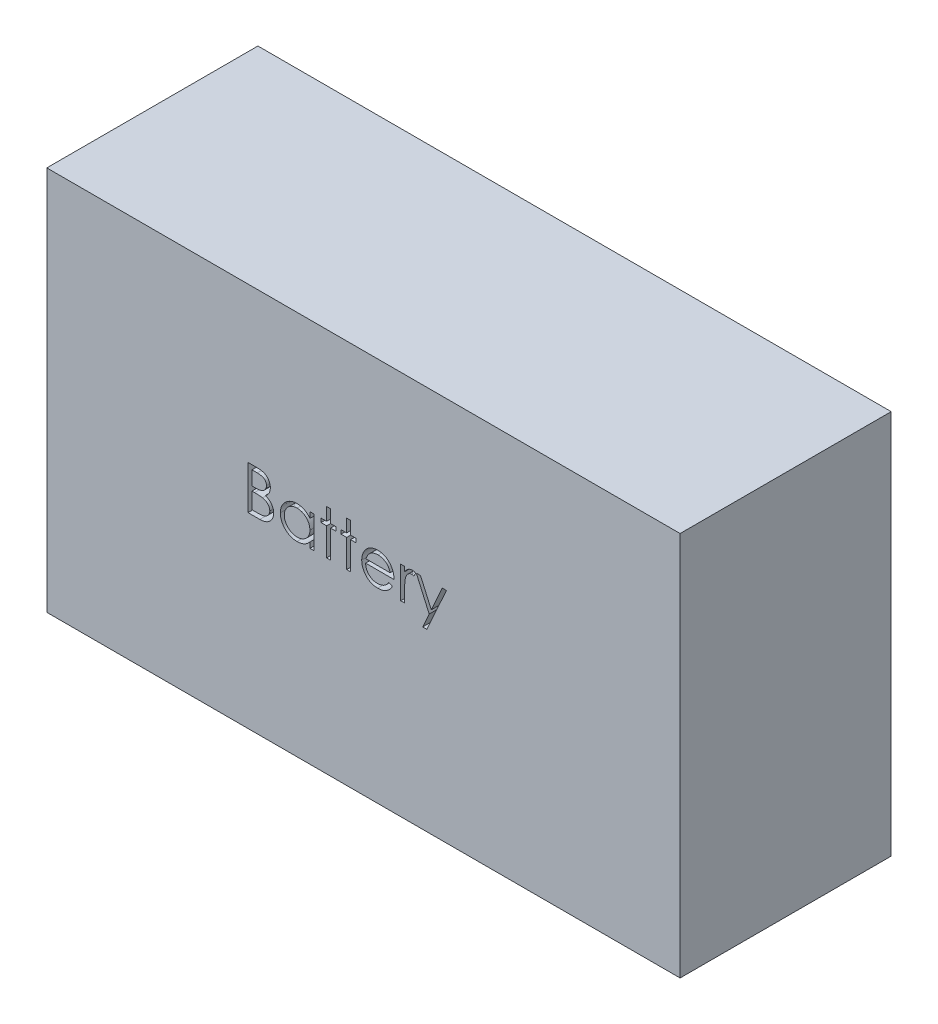
from build123d import *

# Parameters (mm, degrees)
SKETCH1_W           = 51
SKETCH1_H           = 31
BOSS_EXTRUDE1_DEPTH = 17
CUT_EXTRUDE1_DEPTH  = 2


with BuildPart() as part:
    # Sketch1 → Boss-Extrude1 (new body)
    with BuildSketch(Plane.XY):
        Rectangle(SKETCH1_W, SKETCH1_H)
    extrude(amount=BOSS_EXTRUDE1_DEPTH)

    # Sketch2 → Cut-Extrude1 (cut)
    # profile 1 of 7: a face of its own
    with BuildSketch(Plane.XY.offset(17)):
        with BuildLine():
            Line((-9.294257409, 3.05980533), (-8.611364781, 3.05980533))
            add(Edge.make_bspline(
                [(-8.611364781, 3.05980533), (-8.577936303, 3.05962958), (-8.513143593, 3.059288932), (-8.418924151, 3.054005801), (-8.33067534, 3.046802131), (-8.248371568, 3.035372038), (-8.172050865, 3.021580261), (-8.101483228, 3.004878445), (-8.036893056, 2.984851831), (-7.959780319, 2.95300555), (-7.871859659, 2.905682382), (-7.776661266, 2.835753816), (-7.695257026, 2.750221353), (-7.625070709, 2.653738698), (-7.56926959, 2.547602926), (-7.528900292, 2.434343737), (-7.503342417, 2.315421996), (-7.500713983, 2.233778818), (-7.499385614, 2.19251767)],
                knots=[0, 0, 0, 0, 1.001505555, 1.941167018, 2.826882275, 3.653841531, 4.429895133, 5.150066043, 5.825578002, 6.45369114, 7.647487171, 8.808567382, 9.977351308, 11.170798116, 12.373658725, 13.556498008, 14.765093433, 16, 16, 16, 16], degree=3))
            add(Edge.make_bspline(
                [(-7.499385614, 2.19251767), (-7.500478833, 2.153865114), (-7.50262711, 2.077909197), (-7.52316987, 1.966815088), (-7.555330538, 1.861063869), (-7.600035787, 1.761041484), (-7.658137783, 1.669007871), (-7.726996102, 1.584220605), (-7.810072904, 1.510269548), (-7.872316144, 1.468926645), (-7.90393289, 1.447926324)],
                knots=[0, 0, 0, 0, 1.044552857, 2.05264487, 3.044412934, 4.028983338, 5.005914585, 5.980388656, 6.974128949, 8, 8, 8, 8], degree=3))
            add(Edge.make_bspline(
                [(-7.90393289, 1.447926324), (-7.864172462, 1.432661325), (-7.788100915, 1.4034556), (-7.683414903, 1.351820136), (-7.593220058, 1.295658026), (-7.516822912, 1.234326176), (-7.451485257, 1.168217365), (-7.394432315, 1.096362251), (-7.345750941, 1.017823493), (-7.304038017, 0.933419958), (-7.271489261, 0.844013489), (-7.247113357, 0.750442713), (-7.233145908, 0.653043158), (-7.231158267, 0.586757779), (-7.230154845, 0.553294914)],
                knots=[0, 0, 0, 0, 1.27268992, 2.434971085, 3.483601985, 4.442670788, 5.356604649, 6.2567628, 7.179492994, 8.113709626, 9.066344395, 10.018646069, 10.999752585, 12, 12, 12, 12], degree=3))
            add(Edge.make_bspline(
                [(-7.230154845, 0.553294914), (-7.231131691, 0.519128041), (-7.233053663, 0.451903763), (-7.247233635, 0.353148629), (-7.271242742, 0.258773682), (-7.304313888, 0.168168499), (-7.347476203, 0.081508365), (-7.400004167, -0.001304899), (-7.462635731, -0.07943923), (-7.5326986, -0.153762853), (-7.611960745, -0.22059064), (-7.6974765, -0.280106347), (-7.79032282, -0.329052409), (-7.888974814, -0.37016843), (-7.99453913, -0.401575629), (-8.106541738, -0.423548203), (-8.224886039, -0.43835324), (-8.306095791, -0.439570445), (-8.347742986, -0.44019467)],
                knots=[0, 0, 0, 0, 0.978564426, 1.925352924, 2.850884081, 3.763762016, 4.682927383, 5.618979971, 6.567305752, 7.547517671, 8.540179244, 9.531824382, 10.526200242, 11.540722885, 12.589160233, 13.674978461, 14.80764778, 16, 16, 16, 16], degree=3))
            Line((-8.347742986, -0.44019467), (-9.294257409, -0.44019467))
            Line((-9.294257409, -0.44019467), (-9.294257409, 3.05980533))
        make_face()
        with BuildLine():
            Line((-8.980154845, 2.700830971), (-8.980154845, 1.579036099))
            Line((-8.980154845, 1.579036099), (-8.769117185, 1.579036099))
            add(Edge.make_bspline(
                [(-8.769117185, 1.579036099), (-8.73826839, 1.579436022), (-8.67866223, 1.580208755), (-8.592342334, 1.582422272), (-8.512217316, 1.588620316), (-8.438425482, 1.594816578), (-8.371083039, 1.604891165), (-8.310339177, 1.616883288), (-8.25524058, 1.629566193), (-8.191701035, 1.65113568), (-8.119628086, 1.683013355), (-8.042794982, 1.732485192), (-7.975060512, 1.791409545), (-7.917863325, 1.859400507), (-7.871051854, 1.934266692), (-7.838538139, 2.014813573), (-7.816490855, 2.099033705), (-7.814499323, 2.156851958), (-7.813488179, 2.186207574)],
                knots=[0, 0, 0, 0, 1.156816544, 2.235205308, 3.236616184, 4.169592532, 5.011045266, 5.787822928, 6.49130361, 7.128639758, 8.301311294, 9.436451833, 10.541879658, 11.654887649, 12.756523258, 13.837046038, 14.901820046, 16, 16, 16, 16], degree=3))
            add(Edge.make_bspline(
                [(-7.813488179, 2.186207574), (-7.814014359, 2.205633345), (-7.815046519, 2.243739117), (-7.823499821, 2.299288472), (-7.837867396, 2.351532224), (-7.856321689, 2.401186334), (-7.882110378, 2.446698185), (-7.912473841, 2.48964138), (-7.949159531, 2.528553499), (-7.990916844, 2.564922997), (-8.038925467, 2.597167525), (-8.093156759, 2.625408288), (-8.154344436, 2.648149065), (-8.221457291, 2.668065217), (-8.295528378, 2.682053511), (-8.375702931, 2.693706899), (-8.46263765, 2.699639641), (-8.522782753, 2.700425004), (-8.553872794, 2.700830971)],
                knots=[0, 0, 0, 0, 0.91205012, 1.789085906, 2.630437955, 3.453916878, 4.269457761, 5.079663411, 5.91843418, 6.774407191, 7.675494373, 8.627863946, 9.638891023, 10.736472738, 11.911756761, 13.175263542, 14.539845004, 16, 16, 16, 16], degree=3))
            Line((-8.553872794, 2.700830971), (-8.980154845, 2.700830971))
        make_face(mode=Mode.SUBTRACT)
        with BuildLine():
            Line((-8.980154845, 1.22006174), (-8.980154845, -0.081220311))
            Line((-8.980154845, -0.081220311), (-8.53283914, -0.081220311))
            add(Edge.make_bspline(
                [(-8.53283914, -0.081220311), (-8.500820214, -0.080836563), (-8.439107956, -0.080096941), (-8.350006725, -0.077682386), (-8.267423622, -0.072190111), (-8.191735486, -0.063544261), (-8.122125033, -0.054165812), (-8.05942733, -0.041554531), (-8.003134137, -0.02710557), (-7.937859829, -0.004771398), (-7.864356321, 0.029925073), (-7.785145464, 0.082239299), (-7.714719246, 0.144562607), (-7.654913987, 0.216693521), (-7.605900998, 0.295124848), (-7.570245543, 0.378270198), (-7.548254687, 0.464755725), (-7.545592517, 0.523722438), (-7.544257409, 0.553294914)],
                knots=[0, 0, 0, 0, 1.160039823, 2.235823828, 3.228722157, 4.157150951, 4.99529583, 5.772374946, 6.472645482, 7.099169577, 8.269452708, 9.405989375, 10.527446681, 11.663510218, 12.788923519, 13.866172445, 14.929861265, 16, 16, 16, 16], degree=3))
            add(Edge.make_bspline(
                [(-7.544257409, 0.553294914), (-7.544533514, 0.571788254), (-7.545081269, 0.608476636), (-7.553341884, 0.662392455), (-7.565355753, 0.714618328), (-7.580887187, 0.765296069), (-7.603506654, 0.813509445), (-7.629913199, 0.860212005), (-7.660874601, 0.905465484), (-7.709118767, 0.962677738), (-7.779290751, 1.02859475), (-7.878997527, 1.093132253), (-7.992369825, 1.14518006), (-8.074597318, 1.167279536), (-8.117073916, 1.178695555)],
                knots=[0, 0, 0, 0, 0.723448775, 1.435228256, 2.130040452, 2.821711965, 3.505591119, 4.210454504, 4.921174351, 5.648778258, 7.137944449, 8.670945889, 10.280296675, 12, 12, 12, 12], degree=3))
            add(Edge.make_bspline(
                [(-8.117073916, 1.178695555), (-8.134103012, 1.182150639), (-8.171025604, 1.189641973), (-8.231233184, 1.197549677), (-8.299969053, 1.204594736), (-8.37739193, 1.209805894), (-8.463599772, 1.215192438), (-8.55877669, 1.217287259), (-8.662534005, 1.219786519), (-8.734526377, 1.219967653), (-8.771921672, 1.22006174)],
                knots=[0, 0, 0, 0, 0.634451884, 1.375622551, 2.216452059, 3.157844607, 4.20941857, 5.370758133, 6.634282058, 8, 8, 8, 8], degree=3))
            Line((-8.771921672, 1.22006174), (-8.980154845, 1.22006174))
        make_face(mode=Mode.SUBTRACT)
    # profile 2 of 7: a face of its own
    with BuildSketch(Plane.XY.offset(17)):
        with BuildLine():
            Line((-3.999385614, 2.117497638), (-3.999385614, -0.44019467))
            Line((-3.999385614, -0.44019467), (-4.313488179, -0.44019467))
            Line((-4.313488179, -0.44019467), (-4.313488179, 0.002213183))
            add(Edge.make_bspline(
                [(-4.313488179, 0.002213183), (-4.348906969, -0.037826411), (-4.418027184, -0.115964182), (-4.533468302, -0.218046355), (-4.65583648, -0.302424676), (-4.784537801, -0.370574592), (-4.919456045, -0.421766648), (-5.060292132, -0.458152807), (-5.207103513, -0.481546643), (-5.307355868, -0.483882665), (-5.358159653, -0.485066465)],
                knots=[0, 0, 0, 0, 1.074387032, 2.096679803, 3.090159297, 4.057316773, 5.018401886, 5.985159533, 6.978961417, 8, 8, 8, 8], degree=3))
            add(Edge.make_bspline(
                [(-5.358159653, -0.485066465), (-5.403327607, -0.483840092), (-5.492400812, -0.481421632), (-5.623429889, -0.462659328), (-5.749522138, -0.432528707), (-5.870796711, -0.390627817), (-5.986468856, -0.335046996), (-6.097528953, -0.268505748), (-6.203401645, -0.189264917), (-6.302473184, -0.098676889), (-6.393705184, -0.000281902), (-6.473766457, 0.104663645), (-6.540519537, 0.215705949), (-6.596339618, 0.331439103), (-6.639335962, 0.452754022), (-6.669309596, 0.57923119), (-6.688050043, 0.710721064), (-6.690467504, 0.800260587), (-6.691693307, 0.845662702)],
                knots=[0, 0, 0, 0, 1.033919861, 2.038935746, 3.024066025, 3.998881131, 4.97069526, 5.957263378, 6.95902576, 7.993208707, 9.027059324, 10.027763471, 11.009749337, 11.988697705, 12.965288445, 13.950418724, 14.960734635, 16, 16, 16, 16], degree=3))
            add(Edge.make_bspline(
                [(-6.691693307, 0.845662702), (-6.690440335, 0.890126406), (-6.687963279, 0.978028749), (-6.669510059, 1.107307447), (-6.63847905, 1.231825708), (-6.594931202, 1.351182651), (-6.539089247, 1.465522701), (-6.47116116, 1.574926726), (-6.391142036, 1.679696123), (-6.298889629, 1.77736735), (-6.198954858, 1.867587965), (-6.092046128, 1.94599701), (-5.980822846, 2.013713859), (-5.863559836, 2.067367335), (-5.741992731, 2.11077644), (-5.615039285, 2.140809408), (-5.483227706, 2.158506729), (-5.393737214, 2.161069493), (-5.348343948, 2.162369433)],
                knots=[0, 0, 0, 0, 1.020392517, 2.01726096, 2.990465484, 3.961182959, 4.928053699, 5.906110375, 6.912531644, 7.948652711, 8.985773172, 9.998621852, 10.987621588, 11.969261332, 12.953316658, 13.946091881, 14.958173133, 16, 16, 16, 16], degree=3))
            add(Edge.make_bspline(
                [(-5.348343948, 2.162369433), (-5.296144089, 2.160931681), (-5.193782629, 2.158112318), (-5.044054619, 2.134649591), (-4.902410142, 2.095011124), (-4.76775579, 2.041093626), (-4.640575103, 1.969444897), (-4.522072119, 1.879064936), (-4.411006636, 1.770523749), (-4.346626344, 1.687153304), (-4.313488179, 1.644240426)],
                knots=[0, 0, 0, 0, 1.038897134, 2.037228247, 3.008116434, 3.962042015, 4.918381754, 5.904844433, 6.921570401, 8, 8, 8, 8], degree=3))
            Line((-4.313488179, 1.644240426), (-4.313488179, 2.117497638))
            Line((-4.313488179, 2.117497638), (-3.999385614, 2.117497638))
        make_face()
        with BuildLine():
            add(Edge.make_bspline(
                [(-5.344137217, 1.848266869), (-5.390051555, 1.846633231), (-5.480679155, 1.84340869), (-5.613723157, 1.818235195), (-5.741036571, 1.7763506), (-5.861982645, 1.719068699), (-5.974650862, 1.647039963), (-6.075344533, 1.559918579), (-6.164887234, 1.460081565), (-6.240195498, 1.347979455), (-6.301585995, 1.227801364), (-6.344753027, 1.102176926), (-6.373222275, 0.973371948), (-6.376130795, 0.886009262), (-6.377590743, 0.842157093)],
                knots=[0, 0, 0, 0, 1.031046209, 2.035121221, 3.029706178, 4.034933723, 5.034054252, 6.02443088, 7.017295772, 8.038157696, 9.050218397, 10.03989886, 11.016116709, 12, 12, 12, 12], degree=3))
            add(Edge.make_bspline(
                [(-6.377590743, 0.842157093), (-6.375725849, 0.798566986), (-6.372003372, 0.71155763), (-6.345252678, 0.582577053), (-6.300372805, 0.456923011), (-6.239130742, 0.335662018), (-6.162444117, 0.223077917), (-6.073555465, 0.121337795), (-5.971605183, 0.033848206), (-5.858677676, -0.039389367), (-5.738069706, -0.098551888), (-5.611235774, -0.139717528), (-5.480560136, -0.166295308), (-5.391707802, -0.169399785), (-5.346941704, -0.170963901)],
                knots=[0, 0, 0, 0, 0.979072187, 1.954306742, 2.945804271, 3.96968567, 4.997920485, 5.998718438, 6.996577872, 8.005894225, 9.015743152, 10.005417472, 10.995077863, 12, 12, 12, 12], degree=3))
            add(Edge.make_bspline(
                [(-5.346941704, -0.170963901), (-5.301495201, -0.169303937), (-5.211106615, -0.166002433), (-5.077667907, -0.140721168), (-4.948172944, -0.098952369), (-4.824385716, -0.041053243), (-4.709069585, 0.030704113), (-4.605571707, 0.114711204), (-4.518055739, 0.212414388), (-4.443863129, 0.319790841), (-4.385687712, 0.437502838), (-4.343311653, 0.562837029), (-4.318257747, 0.695797777), (-4.315100018, 0.786661704), (-4.313488179, 0.83304251)],
                knots=[0, 0, 0, 0, 1.01762866, 2.023962475, 3.030623092, 4.058876274, 5.077231937, 6.066672613, 7.034107872, 8.005628644, 8.981990164, 9.965428785, 10.961468474, 12, 12, 12, 12], degree=3))
            add(Edge.make_bspline(
                [(-4.313488179, 0.83304251), (-4.314447835, 0.86838034), (-4.316336742, 0.937936374), (-4.330767312, 1.040063891), (-4.353722238, 1.137797617), (-4.386068408, 1.231240306), (-4.428559693, 1.319875322), (-4.479807459, 1.404339082), (-4.540712908, 1.484192293), (-4.610295604, 1.558335364), (-4.686460807, 1.625961826), (-4.767055348, 1.686326067), (-4.853034095, 1.73591484), (-4.942951131, 1.776956111), (-5.036962466, 1.809615261), (-5.135833086, 1.831402955), (-5.238512073, 1.846363276), (-5.308558128, 1.847625657), (-5.344137217, 1.848266869)],
                knots=[0, 0, 0, 0, 1.050140795, 2.067009409, 3.05949893, 4.030605086, 5.00011959, 5.97591094, 6.962425594, 7.979863591, 8.993523472, 9.986985069, 10.967611495, 11.937549037, 12.921786183, 13.919465291, 14.943216303, 16, 16, 16, 16], degree=3))
        make_face(mode=Mode.SUBTRACT)
    # profile 3 of 7: a face of its own
    with BuildSketch(Plane.XY.offset(17)):
        Polygon((-2.967334332, 3.14954892), (-2.653231768, 3.14954892), (-2.653231768, 2.117497638), (-2.20451382, 2.117497638), (-2.20451382, 1.803395074), (-2.653231768, 1.803395074), (-2.653231768, -0.44019467), (-2.967334332, -0.44019467), (-2.967334332, 1.803395074), (-3.416052281, 1.803395074), (-3.416052281, 2.117497638), (-2.967334332, 2.117497638), align=None)
    # profile 4 of 7: a face of its own
    with BuildSketch(Plane.XY.offset(17)):
        Polygon((-1.351949717, 3.14954892), (-1.037847153, 3.14954892), (-1.037847153, 2.117497638), (-0.589129204, 2.117497638), (-0.589129204, 1.803395074), (-1.037847153, 1.803395074), (-1.037847153, -0.44019467), (-1.351949717, -0.44019467), (-1.351949717, 1.803395074), (-1.800667666, 1.803395074), (-1.800667666, 2.117497638), (-1.351949717, 2.117497638), align=None)
    # profile 5 of 7: a face of its own
    with BuildSketch(Plane.XY.offset(17)):
        with BuildLine():
            Line((2.048490988, 0.367497638), (2.327537463, 0.220963183))
            add(Edge.make_bspline(
                [(2.327537463, 0.220963183), (2.305300867, 0.181519851), (2.262037259, 0.104778749), (2.187636511, -0.000653112), (2.109644438, -0.095500828), (2.02454047, -0.177230482), (1.934870791, -0.248481867), (1.840138137, -0.310819692), (1.739849319, -0.363938212), (1.633999594, -0.40869074), (1.521700043, -0.443100234), (1.402678527, -0.467404455), (1.276707031, -0.482427724), (1.190360851, -0.484172864), (1.146147238, -0.485066465)],
                knots=[0, 0, 0, 0, 1.120438281, 2.179929193, 3.190490725, 4.156257408, 5.095198341, 6.022838206, 6.959905092, 7.901321166, 8.864066838, 9.862729781, 10.905609505, 12, 12, 12, 12], degree=3))
            add(Edge.make_bspline(
                [(1.146147238, -0.485066465), (1.097005261, -0.483919289), (1.001143499, -0.481681483), (0.861603752, -0.462389018), (0.730224333, -0.430916659), (0.60701263, -0.386951118), (0.492270378, -0.329523794), (0.385769523, -0.259564312), (0.286949997, -0.177432057), (0.198925788, -0.082415614), (0.119681905, 0.019266343), (0.049756085, 0.125222228), (-0.008701346, 0.235185452), (-0.056253956, 0.348455976), (-0.094658821, 0.46431987), (-0.121425525, 0.583831337), (-0.136855273, 0.706666922), (-0.139219719, 0.789764257), (-0.140411255, 0.831640266)],
                knots=[0, 0, 0, 0, 1.145258523, 2.234067595, 3.276747158, 4.290159414, 5.277019952, 6.260822364, 7.254936242, 8.264827045, 9.274100331, 10.257902744, 11.220704747, 12.172965371, 13.118907548, 14.062713208, 15.023725156, 16, 16, 16, 16], degree=3))
            add(Edge.make_bspline(
                [(-0.140411255, 0.831640266), (-0.139352114, 0.870935097), (-0.137253036, 0.948812261), (-0.124022248, 1.064077806), (-0.100573955, 1.176106258), (-0.068397631, 1.284990706), (-0.026846385, 1.39054884), (0.023985834, 1.492844904), (0.084178212, 1.591770044), (0.130650885, 1.654173177), (0.154059898, 1.685606612)],
                knots=[0, 0, 0, 0, 1.024358464, 2.0301432, 3.019427413, 4.004406732, 4.986367066, 5.972626655, 6.978780325, 8, 8, 8, 8], degree=3))
            add(Edge.make_bspline(
                [(0.154059898, 1.685606612), (0.185767581, 1.723475482), (0.248178528, 1.798013633), (0.353734883, 1.895951959), (0.468035079, 1.977995734), (0.589646706, 2.04600287), (0.71998318, 2.097676517), (0.857292471, 2.136184099), (1.003138057, 2.15776211), (1.102843278, 2.160809944), (1.153859578, 2.162369433)],
                knots=[0, 0, 0, 0, 1.030682036, 2.02871468, 2.997146059, 3.962720338, 4.930598197, 5.918074684, 6.934738563, 8, 8, 8, 8], degree=3))
            add(Edge.make_bspline(
                [(1.153859578, 2.162369433), (1.206307183, 2.161015384), (1.309197429, 2.158359049), (1.45922955, 2.133732715), (1.601190267, 2.094680161), (1.735022771, 2.03952637), (1.860740632, 1.968366818), (1.977526681, 1.880224977), (2.087378194, 1.77780689), (2.151286773, 1.69904368), (2.183807495, 1.658963984)],
                knots=[0, 0, 0, 0, 1.056321875, 2.072262726, 3.055038591, 4.01806755, 4.982017516, 5.957941055, 6.960871419, 8, 8, 8, 8], degree=3))
            add(Edge.make_bspline(
                [(2.183807495, 1.658963984), (2.205934433, 1.628760403), (2.250041026, 1.568554284), (2.305288126, 1.470383127), (2.353245521, 1.367672533), (2.391578482, 1.258762235), (2.422617983, 1.144942655), (2.445074802, 1.025400111), (2.458244421, 0.900170199), (2.460833118, 0.814843644), (2.462152847, 0.771343792)],
                knots=[0, 0, 0, 0, 0.94817472, 1.890038105, 2.849395472, 3.817997239, 4.812318967, 5.836947057, 6.897266129, 8, 8, 8, 8], degree=3))
            Line((2.462152847, 0.771343792), (0.173691309, 0.771343792))
            add(Edge.make_bspline(
                [(0.173691309, 0.771343792), (0.175230915, 0.737643328), (0.178258489, 0.671372724), (0.192373632, 0.574401941), (0.214622406, 0.482028599), (0.245891469, 0.394945557), (0.283758314, 0.312015429), (0.330144031, 0.233853392), (0.385483585, 0.160815462), (0.447209284, 0.092248324), (0.515916379, 0.031187563), (0.588199127, -0.023464213), (0.665092692, -0.06926981), (0.745990775, -0.106449699), (0.83076256, -0.135556016), (0.919434755, -0.155423836), (1.011832872, -0.168730943), (1.074818606, -0.170210608), (1.106884418, -0.170963901)],
                knots=[0, 0, 0, 0, 1.094153842, 2.151609401, 3.174256925, 4.172055639, 5.149267565, 6.128595816, 7.11444997, 8.118368179, 9.117203808, 10.09244225, 11.054858984, 12.015122123, 12.976791628, 13.957293641, 14.960065497, 16, 16, 16, 16], degree=3))
            add(Edge.make_bspline(
                [(1.106884418, -0.170963901), (1.138235565, -0.170355844), (1.200442256, -0.169149343), (1.293083114, -0.157417432), (1.384222641, -0.138447156), (1.473483624, -0.112557166), (1.55905447, -0.080980314), (1.63830002, -0.042877456), (1.711180236, -0.00072771), (1.779297202, 0.047481965), (1.845368196, 0.106490152), (1.910910682, 0.180125873), (1.981187335, 0.267213401), (2.025176928, 0.332759067), (2.048490988, 0.367497638)],
                knots=[0, 0, 0, 0, 0.99110716, 1.966546729, 2.947904876, 3.932708344, 4.903319531, 5.828989031, 6.710028674, 7.56322171, 8.463672341, 9.504779593, 10.677557249, 12, 12, 12, 12], degree=3))
        make_face()
        with BuildLine():
            add(Edge.make_bspline(
                [(2.148050283, 1.085446356), (2.136553658, 1.12710923), (2.114426357, 1.20729685), (2.068189993, 1.318337741), (2.016118452, 1.417025642), (1.95449672, 1.502605275), (1.884677995, 1.578608788), (1.804032812, 1.645027373), (1.713596919, 1.704444824), (1.613837778, 1.754597323), (1.508195993, 1.797287182), (1.397589801, 1.825912298), (1.284732013, 1.84552184), (1.208397727, 1.847347949), (1.169985379, 1.848266869)],
                knots=[0, 0, 0, 0, 1.154881502, 2.222775134, 3.210006277, 4.132804581, 5.035138423, 5.962687519, 6.919655026, 7.923214229, 8.944639381, 9.960483929, 10.97369054, 12, 12, 12, 12], degree=3))
            add(Edge.make_bspline(
                [(1.169985379, 1.848266869), (1.138635941, 1.847655197), (1.076664692, 1.846446051), (0.985363623, 1.834975922), (0.897683924, 1.816016077), (0.812978637, 1.79005112), (0.732357769, 1.755442518), (0.654163, 1.714859291), (0.580382604, 1.665317707), (0.534241309, 1.627558853), (0.510930892, 1.608483215)],
                knots=[0, 0, 0, 0, 1.04873581, 2.073130211, 3.073294108, 4.04793562, 5.032784715, 6.005352987, 6.992311501, 8, 8, 8, 8], degree=3))
            add(Edge.make_bspline(
                [(0.510930892, 1.608483215), (0.49423761, 1.593388899), (0.460454476, 1.562841683), (0.415313954, 1.510212477), (0.372093482, 1.453460914), (0.332759829, 1.39041579), (0.296682242, 1.321795011), (0.262922265, 1.248177376), (0.232535853, 1.169004245), (0.215439743, 1.113831806), (0.206644033, 1.085446356)],
                knots=[0, 0, 0, 0, 0.879870761, 1.780643979, 2.707998968, 3.669668524, 4.684282772, 5.740141944, 6.837334558, 8, 8, 8, 8], degree=3))
            Line((0.206644033, 1.085446356), (2.148050283, 1.085446356))
        make_face(mode=Mode.SUBTRACT)
    # profile 6 of 7: a face of its own
    with BuildSketch(Plane.XY.offset(17)):
        with BuildLine():
            Line((3.000614386, 2.117497638), (3.31471695, 2.117497638))
            Line((3.31471695, 2.117497638), (3.31471695, 1.740995234))
            add(Edge.make_bspline(
                [(3.31471695, 1.740995234), (3.337905708, 1.776051062), (3.382254029, 1.843095062), (3.455966959, 1.931764363), (3.53147029, 2.005179409), (3.609125477, 2.063682928), (3.689503577, 2.107496047), (3.770840529, 2.139589082), (3.854415999, 2.158566397), (3.910577923, 2.161100056), (3.938715347, 2.162369433)],
                knots=[0, 0, 0, 0, 1.2804753, 2.448899062, 3.506932113, 4.484331642, 5.4025378, 6.288909075, 7.142734305, 8, 8, 8, 8], degree=3))
            add(Edge.make_bspline(
                [(3.938715347, 2.162369433), (3.960541674, 2.161178906), (4.005450759, 2.15872932), (4.073433349, 2.141518496), (4.143476801, 2.114040473), (4.188619188, 2.08820025), (4.212152847, 2.074729208)],
                knots=[0, 0, 0, 0, 0.901110191, 1.854092781, 2.881294221, 4, 4, 4, 4], degree=3))
            Line((4.212152847, 2.074729208), (4.039676886, 1.802693952))
            add(Edge.make_bspline(
                [(4.039676886, 1.802693952), (4.024567864, 1.809434218), (3.99588805, 1.822228534), (3.953933484, 1.837370544), (3.915252147, 1.84628646), (3.890608589, 1.847637177), (3.879119995, 1.848266869)],
                knots=[0, 0, 0, 0, 1.180555205, 2.24091978, 3.179933427, 4, 4, 4, 4], degree=3))
            add(Edge.make_bspline(
                [(3.879119995, 1.848266869), (3.853914261, 1.846586831), (3.802501871, 1.843160042), (3.727017372, 1.816221234), (3.653770166, 1.772695994), (3.595598504, 1.724424882), (3.550556251, 1.677877085), (3.518416025, 1.637228682), (3.488933278, 1.591650051), (3.460763058, 1.541920367), (3.435096764, 1.487190521), (3.411142095, 1.428007308), (3.389483232, 1.364302179), (3.377132988, 1.319919659), (3.370806693, 1.297185138)],
                knots=[0, 0, 0, 0, 1.125678352, 2.296057538, 3.5422874, 4.923748041, 5.663163013, 6.437101912, 7.23742474, 8.08941207, 8.991984279, 9.93940061, 10.944477711, 12, 12, 12, 12], degree=3))
            add(Edge.make_bspline(
                [(3.370806693, 1.297185138), (3.3660743, 1.276907964), (3.355592408, 1.231995566), (3.34540087, 1.156647041), (3.335331352, 1.067623382), (3.328234734, 0.964676789), (3.321656692, 0.848064345), (3.31794661, 0.7176084), (3.314843469, 0.573175049), (3.314760402, 0.472200695), (3.31471695, 0.419380651)],
                knots=[0, 0, 0, 0, 0.566838948, 1.255505196, 2.06880316, 3.007127437, 4.065329342, 5.249902469, 6.561414163, 8, 8, 8, 8], degree=3))
            Line((3.31471695, 0.419380651), (3.31471695, -0.44019467))
            Line((3.31471695, -0.44019467), (3.000614386, -0.44019467))
            Line((3.000614386, -0.44019467), (3.000614386, 2.117497638))
        make_face()
    # profile 7 of 7: a face of its own
    with BuildSketch(Plane.XY.offset(17)):
        Polygon((4.257024642, 2.117497638), (4.594965347, 2.117497638), (5.462253007, 0.158563343), (6.340758616, 2.117497638), (6.680101565, 2.117497638), (5.109588745, -1.382502362), (4.770245796, -1.382502362), (5.292581533, -0.220743548), align=None)
    extrude(amount=-CUT_EXTRUDE1_DEPTH, mode=Mode.SUBTRACT)


solid = part.part
